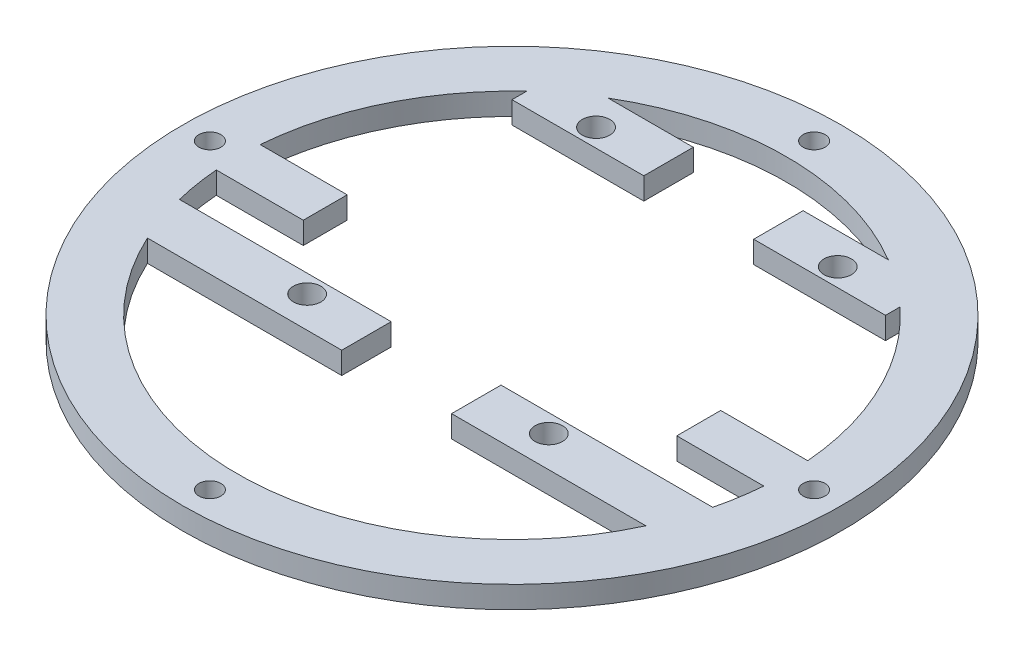
from build123d import *

# Parameters (mm, degrees)
SKETCH1_R           = 30
SKETCH1_R_2         = 25
BOSS_EXTRUDE1_DEPTH = 2
SKETCH2_R           = 1
CUT_EXTRUDE1_DEPTH  = 43.473521163
BOSS_EXTRUDE2_DEPTH = 2
BOSS_EXTRUDE3_DEPTH = 2
CUT_EXTRUDE2_DEPTH  = 2
BOSS_EXTRUDE4_DEPTH = 2
SKETCH16_R          = 1.25
CUT_EXTRUDE3_DEPTH  = 2


with BuildPart() as part:
    # Sketch1 → Boss-Extrude1 (new body)
    with BuildSketch(Plane(origin=(0, 0, 0), x_dir=(1, 0, 0), z_dir=(0, 1, 0))):
        with Locations(Location((0, 0, 0), (0, 0, 270))):
            Circle(SKETCH1_R)
        with Locations(Location((0, 0, 0), (0, 0, 270))):
            Circle(SKETCH1_R_2, mode=Mode.SUBTRACT)
    extrude(amount=BOSS_EXTRUDE1_DEPTH)

    # Sketch2 → Cut-Extrude1 (cut, through all)
    with BuildSketch(Plane(origin=(0, 2, 0), x_dir=(1, 0, 0), z_dir=(0, 1, 0))):
        with Locations(Location((0, 27.5, 0), (0, 0, 270))):
            Circle(SKETCH2_R)
        with Locations(Location((27.5, 0, 0), (0, 0, 270))):
            Circle(SKETCH2_R)
        with Locations(Location((0, -27.5, 0), (0, 0, 270))):
            Circle(SKETCH2_R)
        with Locations(Location((-27.5, 0, 0), (0, 0, 270))):
            Circle(SKETCH2_R)
    extrude(amount=-CUT_EXTRUDE1_DEPTH, mode=Mode.SUBTRACT)

    # Sketch3 → Boss-Extrude2 (add)
    with BuildSketch(Plane(origin=(0, 0, 0), x_dir=(1, 0, 0), z_dir=(0, 1, 0))):
        with BuildLine():
            Line((-24.919871589, -2), (0, -2))
            Line((0, -2), (24.919871589, -2))
            ThreePointArc((24.919871589, -2), (25, 0), (24.919871589, 2))
            Line((24.919871589, 2), (-24.919871589, 2))
            ThreePointArc((-24.919871589, 2), (-25, 0), (-24.919871589, -2))
        make_face()
    extrude(amount=BOSS_EXTRUDE2_DEPTH)

    # Sketch13 → Boss-Extrude3 (add)
    with BuildSketch(Plane(origin=(0, 0, 0), x_dir=(1, 0, 0), z_dir=(0, 1, 0))):
        with BuildLine():
            Line((17, 0), (17, 18.33030278))
            ThreePointArc((17, 18.33030278), (14.962844887, 20.027812484), (12.757350822, 21.5))
            Line((12.757350822, 21.5), (5, 21.5))
            Line((5, 21.5), (5, -10.5))
            Line((5, -10.5), (17, -10.5))
            Line((17, -10.5), (17, 0))
        make_face()
        with BuildLine():
            Line((-5, 0), (-5, 21.5))
            Line((-5, 21.5), (-12.757350822, 21.5))
            ThreePointArc((-12.757350822, 21.5), (-14.962844887, 20.027812484), (-17, 18.33030278))
            Line((-17, 18.33030278), (-17, -10.5))
            Line((-17, -10.5), (-5, -10.5))
            Line((-5, -10.5), (-5, 0))
        make_face()
    extrude(amount=BOSS_EXTRUDE3_DEPTH)

    # Sketch14 → Cut-Extrude2 (cut)
    with BuildSketch(Plane(origin=(0, 2, 0), x_dir=(1, 0, 0), z_dir=(0, 1, 0))):
        Polygon((17, 0), (5, 0), (5, -2), (5, -6), (17, -6), (17, -2), align=None)
        Polygon((5, 2), (5, 0), (17, 0), (17, 2), (17, 17), (5, 17), align=None)
        Polygon((5, 0), (0, 0), (-5, 0), (-5, -2), (5, -2), align=None)
        Polygon((-5, 0), (0, 0), (5, 0), (5, 2), (-5, 2), align=None)
        Polygon((-17, 0), (-5, 0), (-5, 2), (-5, 17), (-17, 17), (-17, 2), align=None)
        Polygon((-5, -2), (-5, 0), (-17, 0), (-17, -2), (-17, -6), (-5, -6), align=None)
    extrude(amount=-CUT_EXTRUDE2_DEPTH, mode=Mode.SUBTRACT)


with BuildPart() as cut_extrude2_piece_1:
    # of the separate pieces the step leaves, piece 1, a body of its own (cut_extrude2_pieces)
    add(part.part.solids().sort_by_distance((0, 0, 30))[0])



with BuildPart() as cut_extrude2_piece_2:
    # of the separate pieces the step leaves, piece 2, a body of its own (cut_extrude2_pieces)
    add(part.part.solids().sort_by_distance((-17, 0, 6))[0])


with BuildPart() as cut_extrude2_piece_3:
    # of the separate pieces the step leaves, piece 3, a body of its own (cut_extrude2_pieces)
    add(part.part.solids().sort_by_distance((17, 0, 10.5))[0])


with BuildPart() as cut_extrude2_piece_1_1:
    add(cut_extrude2_piece_1.part)

    add(cut_extrude2_piece_2.part)  # Boss-Extrude4 merges Cut-Extrude2 piece 2

    add(cut_extrude2_piece_3.part)  # Boss-Extrude4 merges Cut-Extrude2 piece 3
    # Sketch15 → Boss-Extrude4 (add)
    with BuildSketch(Plane(origin=(0, 0, 0), x_dir=(1, 0, 0), z_dir=(0, 1, 0))):
        with BuildLine():
            Line((17, -6), (24.269322199, -6))
            ThreePointArc((24.269322199, -6), (23.586276437, -8.287796079), (22.688102609, -10.5))
            Line((22.688102609, -10.5), (17, -10.5))
            Line((17, -10.5), (17, -6))
        make_face()
        with BuildLine():
            Line((-17, -6), (-24.269322199, -6))
            ThreePointArc((-24.269322199, -6), (-23.586276437, -8.287796079), (-22.688102609, -10.5))
            Line((-22.688102609, -10.5), (-17, -10.5))
            Line((-17, -10.5), (-17, -6))
        make_face()
    extrude(amount=BOSS_EXTRUDE4_DEPTH)

    # Sketch16 → Cut-Extrude3 (cut)
    with BuildSketch(Plane(origin=(0, 2, 0), x_dir=(1, 0, 0), z_dir=(0, 1, 0))):
        with Locations(Location((11, 18.65, 0), (0, 0, 270))):
            Circle(SKETCH16_R)
        with Locations(Location((11, -7.65, 0), (0, 0, 270))):
            Circle(SKETCH16_R)
        with Locations(Location((-11, -7.65, 0), (0, 0, 270))):
            Circle(SKETCH16_R)
        with Locations(Location((-11, 18.65, 0), (0, 0, 270))):
            Circle(SKETCH16_R)
    extrude(amount=-CUT_EXTRUDE3_DEPTH, mode=Mode.SUBTRACT)


solid = cut_extrude2_piece_1_1.part
